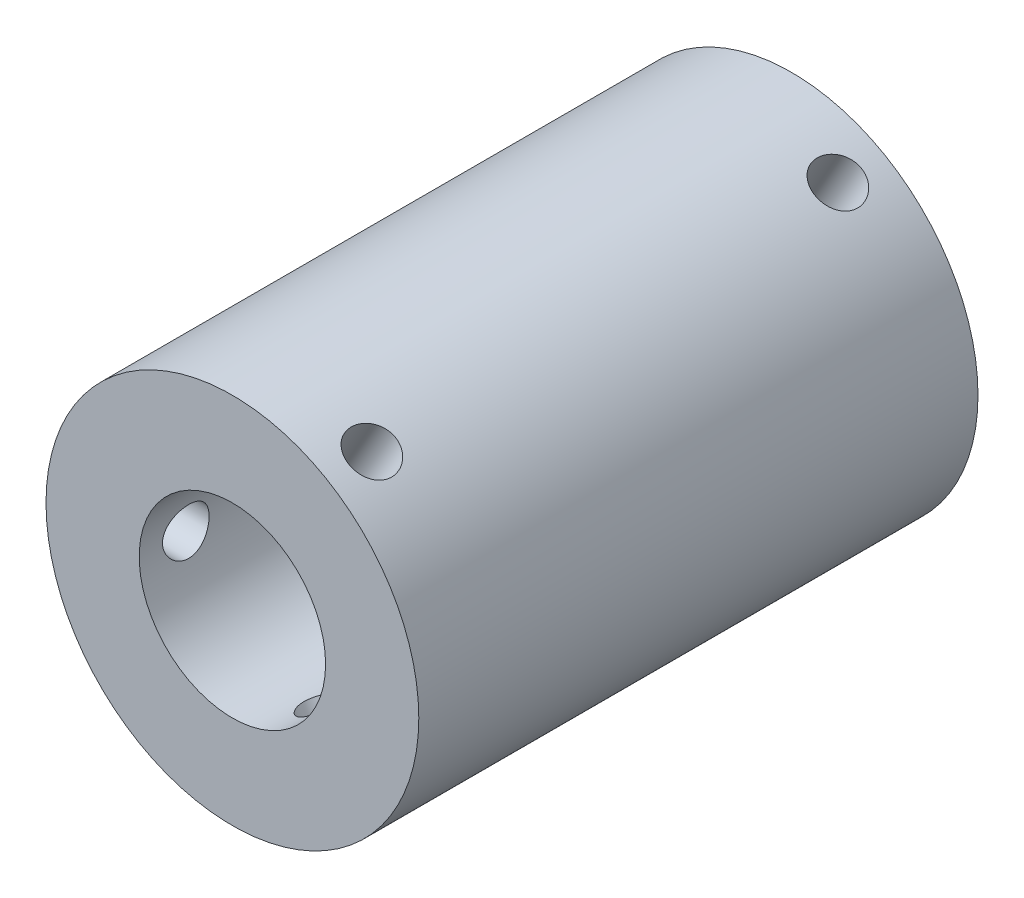
from build123d import *

# Parameters (mm, degrees)
SKETCH1_R           = 12.7
BOSS_EXTRUDE1_DEPTH = 19.05
SKETCH2_R           = 6.35
CUT_EXTRUDE1_DEPTH  = 19.05
SKETCH3_R           = 3.175
CUT_EXTRUDE2_DEPTH  = 19.05
SKETCH4_R           = 1.5875
CUT_EXTRUDE3_DEPTH  = 19.05
CIRPATTERN1_COUNT   = 3


with BuildPart() as part:
    # Sketch1 → Boss-Extrude1 (new, symmetric)
    with BuildSketch(Plane.XY):
        with Locations(Location((0, 0, 0), (0, 0, 180))):
            Circle(SKETCH1_R)
    extrude(amount=BOSS_EXTRUDE1_DEPTH, both=True)

    # Sketch2 → Cut-Extrude1 (cut)
    with BuildSketch(Plane.XY.offset(19.05)):
        Circle(SKETCH2_R)
    extrude(amount=-CUT_EXTRUDE1_DEPTH, mode=Mode.SUBTRACT)

    # Sketch3 → Cut-Extrude2 (cut)
    with BuildSketch(Plane(origin=(0, 0, -19.05), x_dir=(-1, 0, 0), z_dir=(0, 0, -1))):
        Circle(SKETCH3_R)
    extrude(amount=-CUT_EXTRUDE2_DEPTH, mode=Mode.SUBTRACT)

    # Sketch4 → Cut-Extrude3 (cut)
    with BuildSketch(Plane(origin=(0, 0, 0), x_dir=(0, 0, -1), z_dir=(1, 0, 0))):
        with Locations(Location((15.875, 0, 0), (0, 0, 180))):
            Circle(SKETCH4_R)
        with Locations((-15.875, 0)):
            Circle(SKETCH4_R)
    cut_extrude3 = extrude(amount=-CUT_EXTRUDE3_DEPTH, mode=Mode.SUBTRACT)

    # CirPattern1: Cut-Extrude3 ×3 about axis
    cirpattern1_axis = Axis((0, 0, 19.05), (0, 0, -1))
    for i in range(1, CIRPATTERN1_COUNT):
        add(cut_extrude3.rotate(cirpattern1_axis, i * 360 / CIRPATTERN1_COUNT), mode=Mode.SUBTRACT)


solid = part.part
